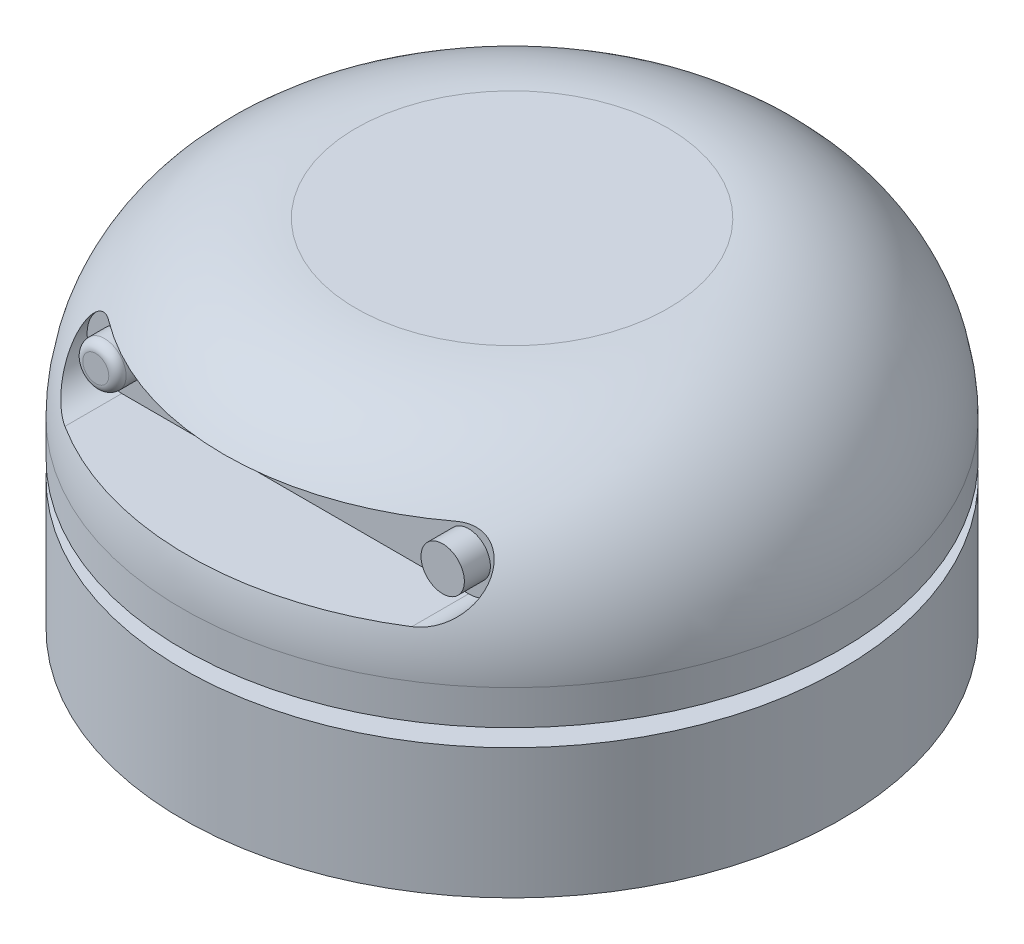
from build123d import *

# Parameters (mm, degrees)
CUT_EXTRUDE_START   = 40
CUT_EXTRUDE_1_DEPTH = 15
SKETCH_3_R          = 2.5
EXTRUDE_1_DEPTH     = 3
FILLET_1_R          = 1


with BuildPart() as part:
    # 草图1 → 旋转1 (revolve)
    with BuildSketch(Plane.XY, mode=Mode.PRIVATE) as revolve_1_sk:
        with BuildLine():
            Line((0, 0), (38, 0))
            Line((38, 0), (38, 15))
            Line((38, 15), (35, 15))
            Line((35, 15), (35, 17))
            Line((35, 17), (38, 17))
            Line((38, 17), (38, 21))
            ThreePointArc((38, 21), (32.142135624, 35.142135624), (18, 41))
            Line((18, 41), (0, 41))
            Line((0, 41), (0, 0))
        make_face()
    revolve(revolve_1_sk.sketch.rotate(Axis((0, 0, 0), (0, 1, 0)), 90), axis=Axis((0, 0, 0), (0, 1, 0)))

    # 草图2 → 切除-拉伸1 (cut)
    with BuildSketch(Plane.XY.offset(CUT_EXTRUDE_START)):
        with BuildLine():
            Line((-20, 34), (20, 34))
            ThreePointArc((20, 34), (24, 30), (20, 26))
            Line((20, 26), (-20, 26))
            ThreePointArc((-20, 26), (-24, 30), (-20, 34))
        make_face()
    extrude(amount=-CUT_EXTRUDE_1_DEPTH, mode=Mode.SUBTRACT)

    # 草图3 → 凸台-拉伸1 (add)
    with BuildSketch(Plane.XY.offset(25)):
        with Locations((-20, 30)):
            Circle(SKETCH_3_R)
        with Locations((20, 30)):
            Circle(SKETCH_3_R)
    extrude(amount=EXTRUDE_1_DEPTH)

    # 圆角1
    fillet_1_edges = [part.edges().sort_by_distance(p)[0] for p in [
        (-22.5, 30, 28),
    ]]
    fillet(fillet_1_edges, radius=FILLET_1_R)


solid = part.part
